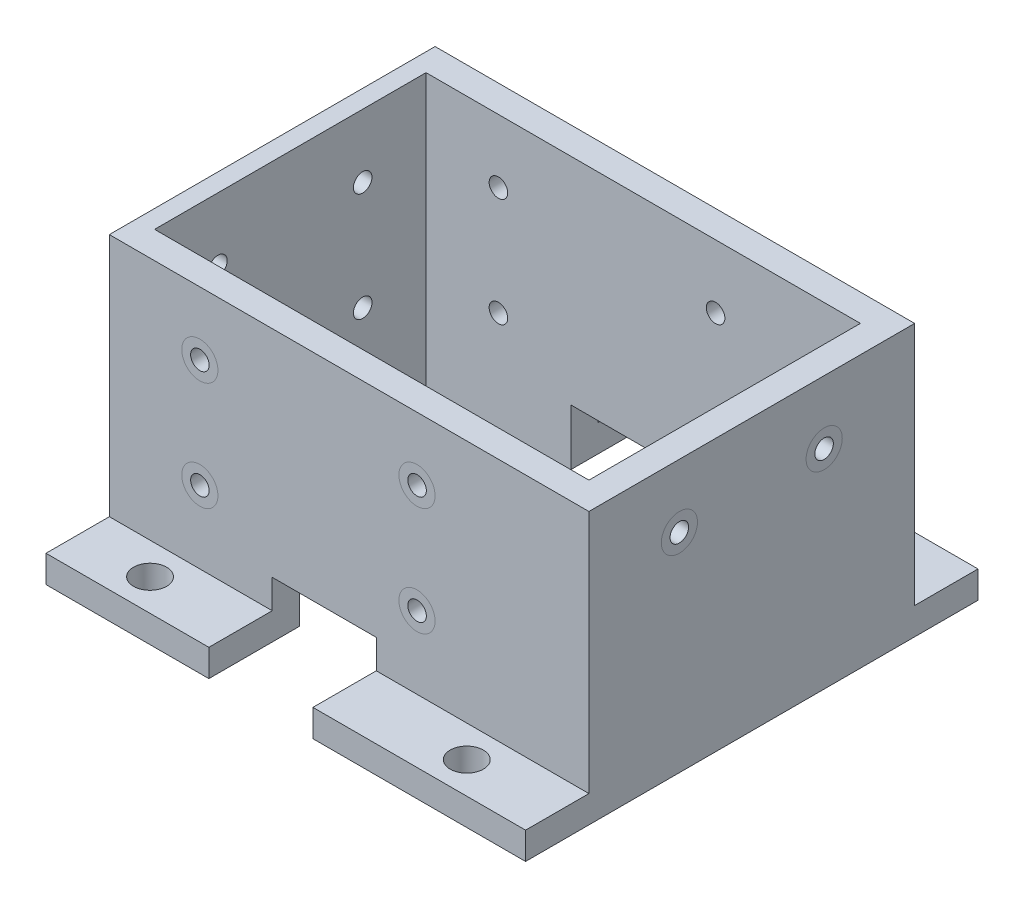
from build123d import *

# Parameters (mm, degrees)
SKETCH1_W                      = 36
SKETCH1_H                      = 38
BOSS_EXTRUDE2_DEPTH            = 53
SKETCH3_W                      = 30
SKETCH3_H                      = 35
CUT_EXTRUDE1_DEPTH             = 51
SKETCH4_W                      = 3
SKETCH4_H                      = 30
BOSS_EXTRUDE3_DEPTH            = 33
SKETCH5_W                      = 53
SKETCH5_H                      = 8
CUT_EXTRUDE2_DEPTH             = 52
SKETCH6_W                      = 53
SKETCH6_H                      = 7
BOSS_EXTRUDE4_DEPTH            = 3
CUT_EXTRUDE4_DEPTH             = 79.797208072
CUT_EXTRUDE4_DEPTH_BACK        = 79.797208072
SKETCH8_W                      = 11.5
SKETCH8_H                      = 3
M2_5_TAPPED_HOLE13_D           = 2.05
M2_5_TAPPED_HOLE13_DEPTH       = 3
M2_5_TAPPED_HOLE13_CSINK_D     = 4
M2_5_TAPPED_HOLE13_CSINK_ANGLE = 179
LPATTERN1_COUNT                = 2
LPATTERN1_PITCH                = 24
LPATTERN1_COUNT_DIR2           = 2
LPATTERN1_PITCH_DIR2           = 12
M2_5_TAPPED_HOLE14_D           = 2.05
M2_5_TAPPED_HOLE14_DEPTH       = 2
M2_5_TAPPED_HOLE14_CSINK_D     = 4
M2_5_TAPPED_HOLE14_CSINK_ANGLE = 179
LPATTERN2_COUNT                = 2
LPATTERN2_PITCH                = 16
LPATTERN2_COUNT_DIR2           = 2
LPATTERN2_PITCH_DIR2           = 12
M2_5_TAPPED_HOLE15_D           = 2.05
M2_5_TAPPED_HOLE15_CSINK_D     = 4
M2_5_TAPPED_HOLE15_CSINK_ANGLE = 179
LPATTERN3_COUNT                = 2
LPATTERN3_PITCH                = 16
M2_5_TAPPED_HOLE16_D           = 2.05
M2_5_TAPPED_HOLE16_CSINK_D     = 4
M2_5_TAPPED_HOLE16_CSINK_ANGLE = 179
LPATTERN4_COUNT                = 2
LPATTERN4_PITCH                = 24
LPATTERN4_COUNT_DIR2           = 2
LPATTERN4_PITCH_DIR2           = 12
SKETCH45_R                     = 1.833333333
CUT_EXTRUDE5_DEPTH             = 74.396185187
LPATTERN5_COUNT                = 2
LPATTERN5_PITCH                = 35
LPATTERN5_COUNT_DIR2           = 2
LPATTERN5_PITCH_DIR2           = 43
CUT_EXTRUDE6_DEPTH             = 75.551995278
CUT_EXTRUDE6_DEPTH_BACK        = 75.551995278
SKETCH46_W                     = 11.5
SKETCH46_H                     = 3.2


with BuildPart() as part:
    # Sketch1 → Boss-Extrude2 (new body)
    with BuildSketch(Plane(origin=(0, 0, 0), x_dir=(0, 0, -1), z_dir=(1, 0, 0))):
        with Locations((18, 19)):
            Rectangle(SKETCH1_W, SKETCH1_H)
    extrude(amount=BOSS_EXTRUDE2_DEPTH)

    # Sketch3 → Cut-Extrude1 (cut)
    with BuildSketch(Plane(origin=(53, 0, 0), x_dir=(0, 0, -1), z_dir=(1, 0, 0))):
        with Locations((18, 17.5)):
            Rectangle(SKETCH3_W, SKETCH3_H)
    extrude(amount=-CUT_EXTRUDE1_DEPTH, mode=Mode.SUBTRACT)

    # Sketch4 → Boss-Extrude3 (add)
    with BuildSketch(Plane.XY):
        with Locations((51.5, 15)):
            Rectangle(SKETCH4_W, SKETCH4_H)
    extrude(amount=-BOSS_EXTRUDE3_DEPTH)

    # Sketch5 → Cut-Extrude2 (cut)
    with BuildSketch(Plane.XY):
        with Locations((26.5, 34)):
            Rectangle(SKETCH5_W, SKETCH5_H)
    extrude(amount=-CUT_EXTRUDE2_DEPTH, mode=Mode.SUBTRACT)

    # Sketch6 → Boss-Extrude4 (add)
    with BuildSketch(Plane(origin=(0, 0, 0), x_dir=(-1, 0, 0), z_dir=(0, -1, 0))):
        with Locations((-26.5, -3.5)):
            Rectangle(SKETCH6_W, SKETCH6_H)
        with Locations((-26.5, 39.5)):
            Rectangle(SKETCH6_W, SKETCH6_H)
    extrude(amount=-BOSS_EXTRUDE4_DEPTH)

    # Sketch8 → Cut-Extrude4 (cut, two sides: drawn at the far end of the back side and taken through both)
    with BuildSketch(Plane(origin=(0, 0, -43), x_dir=(-1, 0, 0), z_dir=(0, 0, -1)).offset(-CUT_EXTRUDE4_DEPTH_BACK)):
        with Locations((-23.75, 1.5)):
            Rectangle(SKETCH8_W, SKETCH8_H)
    extrude(amount=CUT_EXTRUDE4_DEPTH + CUT_EXTRUDE4_DEPTH_BACK, mode=Mode.SUBTRACT)

    # M2.5 Tapped Hole13
    with Locations(Plane.XY):
        with Locations((10, 23)):
            m2_5_tapped_hole13 = CounterSinkHole(M2_5_TAPPED_HOLE13_D / 2, M2_5_TAPPED_HOLE13_CSINK_D / 2, depth=M2_5_TAPPED_HOLE13_DEPTH, counter_sink_angle=M2_5_TAPPED_HOLE13_CSINK_ANGLE)

    # LPattern1: M2.5 Tapped Hole13 2 × 2
    with Locations(*[(i * LPATTERN1_PITCH, -j * LPATTERN1_PITCH_DIR2, 0) for i in range(LPATTERN1_COUNT) for j in range(LPATTERN1_COUNT_DIR2) if (i, j) != (0, 0)]):
        add(m2_5_tapped_hole13, mode=Mode.SUBTRACT)

    # M2.5 Tapped Hole14
    with Locations(Plane.ZY):
        with Locations((-26, 23)):
            m2_5_tapped_hole14 = CounterSinkHole(M2_5_TAPPED_HOLE14_D / 2, M2_5_TAPPED_HOLE14_CSINK_D / 2, depth=M2_5_TAPPED_HOLE14_DEPTH, counter_sink_angle=M2_5_TAPPED_HOLE14_CSINK_ANGLE)

    # LPattern2: M2.5 Tapped Hole14 2 × 2
    with Locations(*[(0, -j * LPATTERN2_PITCH_DIR2, i * LPATTERN2_PITCH) for i in range(LPATTERN2_COUNT) for j in range(LPATTERN2_COUNT_DIR2) if (i, j) != (0, 0)]):
        add(m2_5_tapped_hole14, mode=Mode.SUBTRACT)

    # M2.5 Tapped Hole15 (through all)
    with Locations(Plane(origin=(53, 0, 0), x_dir=(0, 0, -1), z_dir=(1, 0, 0))):
        with Locations((26, 23)):
            m2_5_tapped_hole15 = CounterSinkHole(M2_5_TAPPED_HOLE15_D / 2, M2_5_TAPPED_HOLE15_CSINK_D / 2, counter_sink_angle=M2_5_TAPPED_HOLE15_CSINK_ANGLE)

    # LPattern3: M2.5 Tapped Hole15 ×2
    with Locations(*[(0, 0, i * LPATTERN3_PITCH) for i in range(1, LPATTERN3_COUNT)]):
        add(m2_5_tapped_hole15, mode=Mode.SUBTRACT)

    # M2.5 Tapped Hole16 (through all)
    with Locations(Plane(origin=(0, 0, -36), x_dir=(-1, 0, 0), z_dir=(0, 0, -1))):
        with Locations((-10, 23)):
            m2_5_tapped_hole16 = CounterSinkHole(M2_5_TAPPED_HOLE16_D / 2, M2_5_TAPPED_HOLE16_CSINK_D / 2, counter_sink_angle=M2_5_TAPPED_HOLE16_CSINK_ANGLE)

    # LPattern4: M2.5 Tapped Hole16 2 × 2
    with Locations(*[(i * LPATTERN4_PITCH, -j * LPATTERN4_PITCH_DIR2, 0) for i in range(LPATTERN4_COUNT) for j in range(LPATTERN4_COUNT_DIR2) if (i, j) != (0, 0)]):
        add(m2_5_tapped_hole16, mode=Mode.SUBTRACT)

    # Sketch45 → Cut-Extrude5 (cut, symmetric)
    with BuildSketch(Plane(origin=(0, 3, 0), x_dir=(1, 0, 0), z_dir=(0, 1, 0))):
        with Locations(Location((8, 39.5, 0), (0, 0, 270))):
            Circle(SKETCH45_R)
    cut_extrude5 = extrude(amount=CUT_EXTRUDE5_DEPTH, both=True, mode=Mode.SUBTRACT)

    # LPattern5: Cut-Extrude5 2 × 2
    with Locations(*[(i * LPATTERN5_PITCH, 0, j * LPATTERN5_PITCH_DIR2) for i in range(LPATTERN5_COUNT) for j in range(LPATTERN5_COUNT_DIR2) if (i, j) != (0, 0)]):
        add(cut_extrude5, mode=Mode.SUBTRACT)

    # Sketch46 → Cut-Extrude6 (cut, two sides: drawn at the far end of the back side and taken through both)
    with BuildSketch(Plane(origin=(0, 0, -36), x_dir=(-1, 0, 0), z_dir=(0, 0, -1)).offset(-CUT_EXTRUDE6_DEPTH_BACK)):
        with Locations((-23.75, 4.6)):
            Rectangle(SKETCH46_W, SKETCH46_H)
    extrude(amount=CUT_EXTRUDE6_DEPTH + CUT_EXTRUDE6_DEPTH_BACK, mode=Mode.SUBTRACT)


solid = part.part
